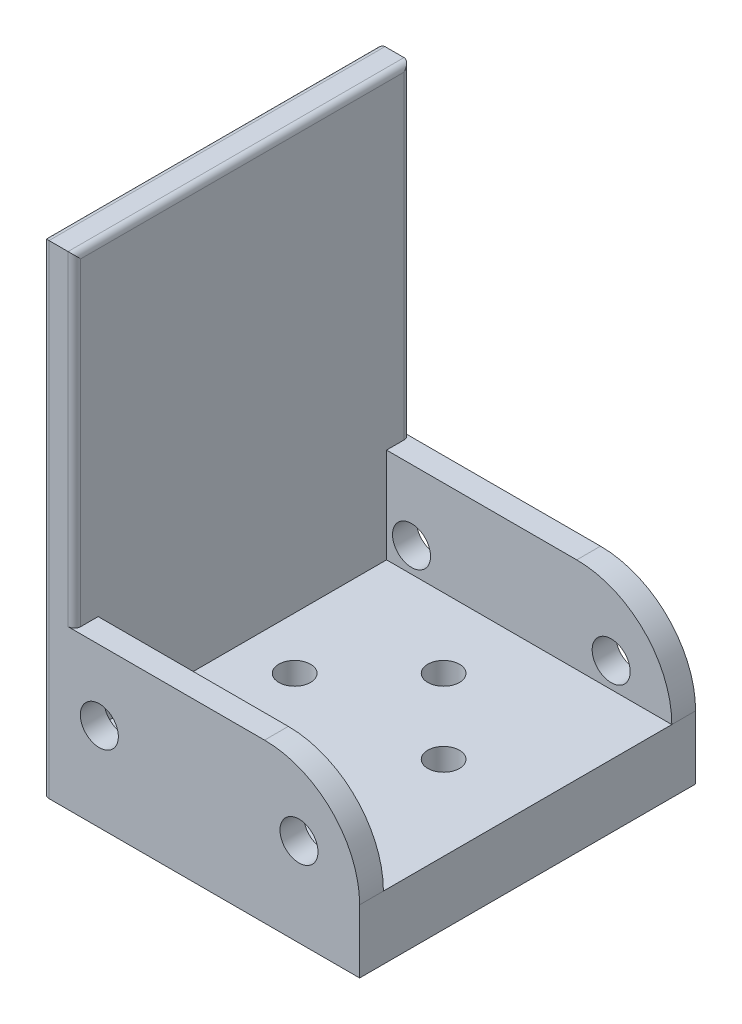
from build123d import *

# Parameters (mm, degrees)
SKETCH1_W           = 25.4
SKETCH1_H           = 26.924
BOSS_EXTRUDE1_DEPTH = 5.08
SKETCH2_W           = 25.4
SKETCH2_H           = 1.905
BOSS_EXTRUDE2_DEPTH = 7.62
FILLET1_R           = 7.62
SKETCH4_W           = 26.924
SKETCH4_H           = 38.735
BOSS_EXTRUDE3_DEPTH = 2.54
SKETCH6_R           = 1.27
CUT_EXTRUDE2_DEPTH  = 43.929193668
FILLET2_R           = 0.508
SKETCH8_R           = 1.524
CUT_EXTRUDE4_DEPTH  = 49.852758377


with BuildPart() as part:
    # Sketch1 → Boss-Extrude1 (new body)
    with BuildSketch(Plane(origin=(0, 0, 0), x_dir=(1, 0, 0), z_dir=(0, 1, 0))):
        Rectangle(SKETCH1_W, SKETCH1_H)
    extrude(amount=BOSS_EXTRUDE1_DEPTH)

    # Sketch2 → Boss-Extrude2 (add)
    with BuildSketch(Plane(origin=(0, 5.08, 0), x_dir=(1, 0, 0), z_dir=(0, 1, 0))):
        with Locations((0, 12.5095)):
            Rectangle(SKETCH2_W, SKETCH2_H)
        with Locations((0, -12.5095)):
            Rectangle(SKETCH2_W, SKETCH2_H)
    extrude(amount=BOSS_EXTRUDE2_DEPTH)

    # Fillet1
    fillet1_edges = [part.edges().sort_by_distance(p)[0] for p in [
        (12.7, 12.7, -12.5095),
        (12.7, 12.7, 12.5095),
    ]]
    fillet(fillet1_edges, radius=FILLET1_R)

    # Sketch4 → Boss-Extrude3 (add)
    with BuildSketch(Plane.ZY.offset(12.7)):
        with Locations((0, 19.3675)):
            Rectangle(SKETCH4_W, SKETCH4_H)
    extrude(amount=-BOSS_EXTRUDE3_DEPTH)

    # Sketch6 → Cut-Extrude2 (cut, through all)
    with BuildSketch(Plane.XZ):
        with Locations((0, 5.969)):
            Circle(SKETCH6_R)
        with Locations((5.969, 0)):
            Circle(SKETCH6_R)
        with Locations((0, -5.969)):
            Circle(SKETCH6_R)
        with Locations((-5.969, 0)):
            Circle(SKETCH6_R)
    extrude(amount=-CUT_EXTRUDE2_DEPTH, mode=Mode.SUBTRACT)

    # Fillet2
    fillet2_edges = [part.edges().sort_by_distance(p)[0] for p in [
        (-10.16, 38.735, 0),
        (-12.7, 38.735, 0),
        (-10.16, 25.7175, 13.462),
        (-12.7, 19.3675, 13.462),
        (-12.7, 19.3675, -13.462),
        (-10.16, 25.7175, -13.462),
    ]]
    fillet(fillet2_edges, radius=FILLET2_R)

    # Sketch8 → Cut-Extrude4 (cut, through all)
    with BuildSketch(Plane(origin=(0, 0, -13.462), x_dir=(-1, 0, 0), z_dir=(0, 0, -1))):
        with Locations((-7.84, 7.08)):
            Circle(SKETCH8_R)
        with Locations((8.16, 7.08)):
            Circle(SKETCH8_R)
    extrude(amount=-CUT_EXTRUDE4_DEPTH, mode=Mode.SUBTRACT)


solid = part.part
